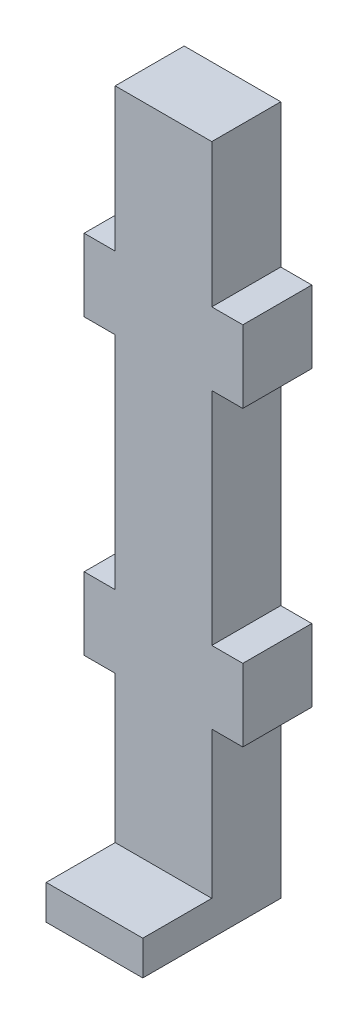
from build123d import *

# Parameters (mm, degrees)
SKETCH1_W               = 5.6
SKETCH1_H               = 40
BOSS_EXTRUDE1_DEPTH     = 4
SKETCH2_W               = 5.6
SKETCH2_H               = 2
BOSS_EXTRUDE2_DEPTH     = 4
SKETCH4_W               = 4
SKETCH4_H               = 4.2
BOSS_EXTRUDE3_DEPTH     = 1.8
MIRROR2_COPY_1_SKETCH_W = 4
MIRROR2_COPY_1_SKETCH_H = 4.2
MIRROR2_COPY_1_DEPTH    = 1.8


with BuildPart() as part:
    # Sketch1 → Boss-Extrude1 (new body)
    with BuildSketch(Plane.XY):
        Rectangle(SKETCH1_W, SKETCH1_H)
    extrude(amount=BOSS_EXTRUDE1_DEPTH)

    # Sketch2 → Boss-Extrude2 (add)
    with BuildSketch(Plane.XY.offset(4)):
        with Locations((0, -19)):
            Rectangle(SKETCH2_W, SKETCH2_H)
    extrude(amount=BOSS_EXTRUDE2_DEPTH)

    # Sketch4 → Boss-Extrude3 (add)
    with BuildSketch(Plane.ZY.offset(2.8)):
        with Locations((2, 9.6)):
            Rectangle(SKETCH4_W, SKETCH4_H)
    boss_extrude3 = extrude(amount=BOSS_EXTRUDE3_DEPTH)

    # Mirror1: Boss-Extrude3 across plane
    add(boss_extrude3.mirror(Plane.ZY))

    # Mirror2: Boss-Extrude3 across plane
    add(boss_extrude3.mirror(Plane(origin=(0, 1.1, 0), x_dir=(0, 0, 1), z_dir=(0, -1, 0))))

    # Mirror2 copy 1 sketch → Mirror2 copy 1 (add)
    with BuildSketch(Plane(origin=(2.8, 2.2, 0), x_dir=(0, 0, 1), z_dir=(1, 0, 0))):
        with Locations((2, 9.6)):
            Rectangle(MIRROR2_COPY_1_SKETCH_W, MIRROR2_COPY_1_SKETCH_H)
    extrude(amount=MIRROR2_COPY_1_DEPTH)


solid = part.part
